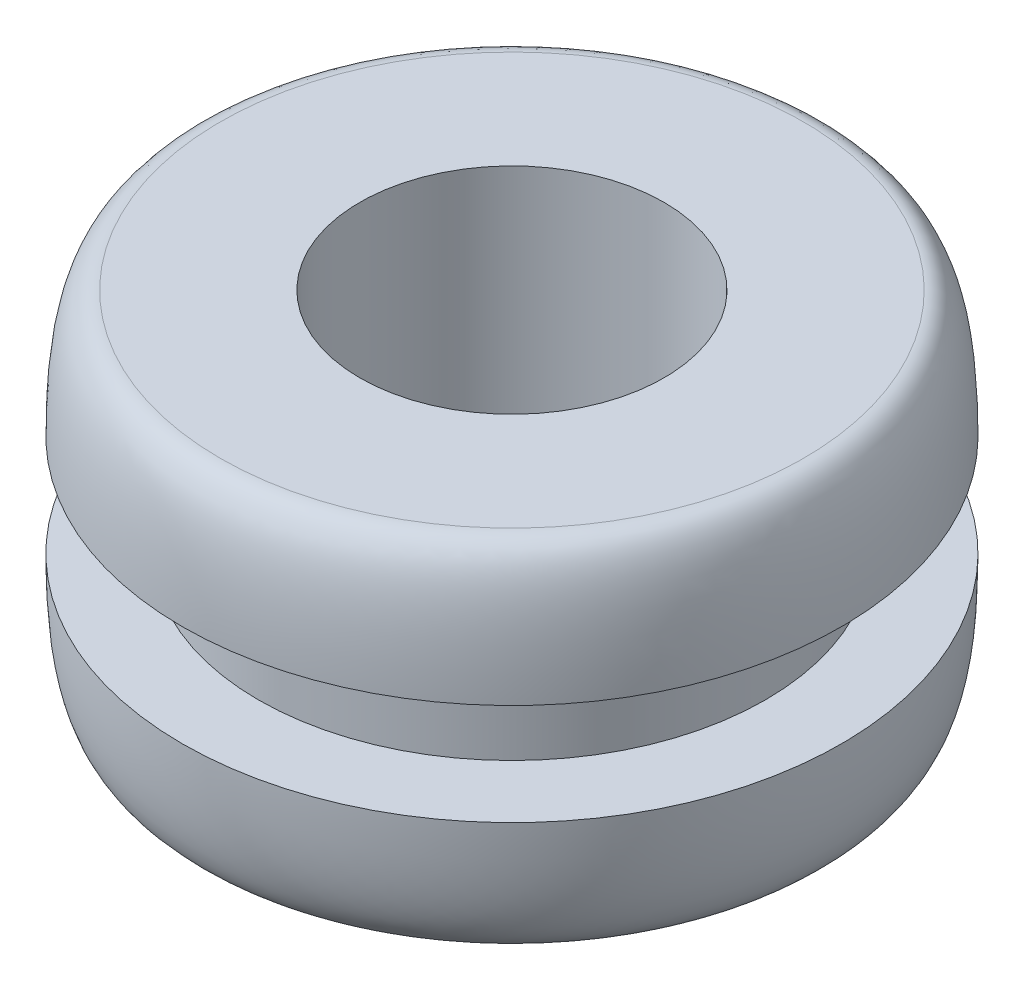
from build123d import *


with BuildPart() as part:
    # Sketch1 → Revolve1 (revolve)
    with BuildSketch(Plane.XY, mode=Mode.PRIVATE) as revolve1_sk:
        with BuildLine():
            Line((-2.38125, 2.778125), (-2.38125, -2.778125))
            Line((-2.38125, -2.778125), (-4.5640625, -2.778125))
            add(Edge.make_bspline(
                [(-4.5640625, -2.778125), (-5.042424348, -2.778125), (-5.159375, -1.832832331), (-5.159375, -0.79375)],
                knots=[0, 0, 0, 0, 1, 1, 1, 1], degree=3))
            Line((-5.159375, -0.79375), (-3.96875, -0.79375))
            Line((-3.96875, -0.79375), (-3.96875, 0.79375))
            Line((-3.96875, 0.79375), (-5.159375, 0.79375))
            add(Edge.make_bspline(
                [(-4.5640625, 2.778125), (-5.042424348, 2.778125), (-5.159375, 1.832832331), (-5.159375, 0.79375)],
                knots=[0, 0, 0, 0, 1, 1, 1, 1], degree=3))
            Line((-4.5640625, 2.778125), (-2.38125, 2.778125))
        make_face()
    revolve(revolve1_sk.sketch.rotate(Axis((0, 96.264631407, 0), (0, -1, 0)), 270), axis=Axis((0, 96.264631407, 0), (0, -1, 0)))


solid = part.part
